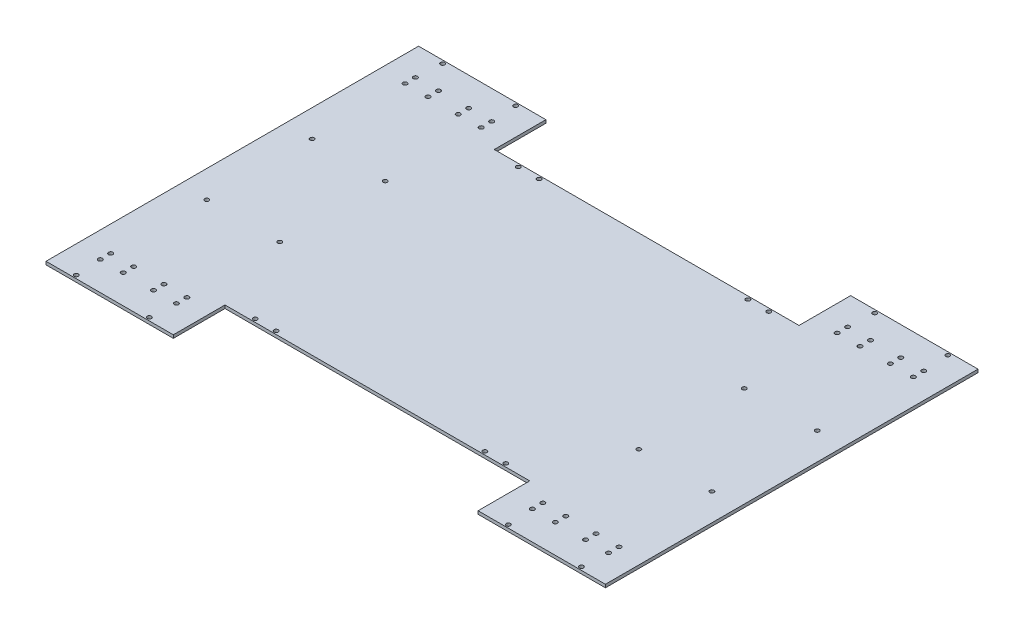
from build123d import *

# Parameters (mm, degrees)
EXTRUDE_1_DEPTH     = 3
SKETCH_6_R          = 2
SKETCH_6_R_2        = 2.05
CUT_EXTRUDE_2_DEPTH = 3


with BuildPart() as part:
    # 草图1 → 凸台-拉伸1 (new body)
    with BuildSketch(Plane(origin=(0, 0, 0), x_dir=(1, 0, 0), z_dir=(0, 1, 0))):
        Polygon((-268, 178.5), (-268, -178.5), (-146, -178.5), (-146, -129), (146, -129), (146, -178.5), (268, -178.5), (268, 178.5), (146, 178.5), (146, 129), (-146, 129), (-146, 178.5), align=None)
    extrude(amount=EXTRUDE_1_DEPTH)

    # 草图6 → 切除-拉伸2 (cut)
    with BuildSketch(Plane.XZ):
        with Locations(Location((172, 175.5, 0), (0, 0, 270))):
            Circle(SKETCH_6_R)
        with Locations(Location((242, 175.5, 0), (0, 0, 270))):
            Circle(SKETCH_6_R)
        with Locations(Location((170.5, 151, 0), (0, 0, 270))):
            Circle(SKETCH_6_R_2)
        with Locations(Location((192.5, 151, 0), (0, 0, 270))):
            Circle(SKETCH_6_R_2)
        with Locations(Location((192.5, 141, 0), (0, 0, 270))):
            Circle(SKETCH_6_R_2)
        with Locations(Location((170.5, 141, 0), (0, 0, 270))):
            Circle(SKETCH_6_R_2)
        with Locations(Location((221.5, 151, 0), (0, 0, 270))):
            Circle(SKETCH_6_R_2)
        with Locations(Location((221.5, 141, 0), (0, 0, 270))):
            Circle(SKETCH_6_R_2)
        with Locations(Location((243.5, 151, 0), (0, 0, 270))):
            Circle(SKETCH_6_R_2)
        with Locations(Location((243.5, 141, 0), (0, 0, 270))):
            Circle(SKETCH_6_R_2)
        with Locations(Location((172, 50.5, 0), (0, 0, 270))):
            Circle(SKETCH_6_R)
        with Locations(Location((242, 50.5, 0), (0, 0, 270))):
            Circle(SKETCH_6_R)
        with Locations(Location((100, 126, 0), (0, 0, 270))):
            Circle(SKETCH_6_R)
        with Locations(Location((120, 126, 0), (0, 0, 270))):
            Circle(SKETCH_6_R)
        with Locations(Location((242, -50.5, 0), (0, 0, 90))):
            Circle(SKETCH_6_R)
        with Locations(Location((172, -50.5, 0), (0, 0, 90))):
            Circle(SKETCH_6_R)
        with Locations(Location((243.5, -141, 0), (0, 0, 90))):
            Circle(SKETCH_6_R_2)
        with Locations(Location((243.5, -151, 0), (0, 0, 90))):
            Circle(SKETCH_6_R_2)
        with Locations(Location((221.5, -141, 0), (0, 0, 90))):
            Circle(SKETCH_6_R_2)
        with Locations(Location((221.5, -151, 0), (0, 0, 90))):
            Circle(SKETCH_6_R_2)
        with Locations(Location((192.5, -141, 0), (0, 0, 90))):
            Circle(SKETCH_6_R_2)
        with Locations(Location((170.5, -141, 0), (0, 0, 90))):
            Circle(SKETCH_6_R_2)
        with Locations(Location((170.5, -151, 0), (0, 0, 90))):
            Circle(SKETCH_6_R_2)
        with Locations(Location((192.5, -151, 0), (0, 0, 90))):
            Circle(SKETCH_6_R_2)
        with Locations(Location((242, -175.5, 0), (0, 0, 90))):
            Circle(SKETCH_6_R)
        with Locations(Location((172, -175.5, 0), (0, 0, 90))):
            Circle(SKETCH_6_R)
        with Locations(Location((120, -126, 0), (0, 0, 90))):
            Circle(SKETCH_6_R)
        with Locations(Location((100, -126, 0), (0, 0, 90))):
            Circle(SKETCH_6_R)
        with Locations(Location((-172, -175.5, 0), (0, 0, 270))):
            Circle(SKETCH_6_R)
        with Locations(Location((-242, -175.5, 0), (0, 0, 270))):
            Circle(SKETCH_6_R)
        with Locations(Location((-221.5, -151, 0), (0, 0, 270))):
            Circle(SKETCH_6_R_2)
        with Locations(Location((-243.5, -151, 0), (0, 0, 270))):
            Circle(SKETCH_6_R_2)
        with Locations(Location((-243.5, -141, 0), (0, 0, 270))):
            Circle(SKETCH_6_R_2)
        with Locations(Location((-221.5, -141, 0), (0, 0, 270))):
            Circle(SKETCH_6_R_2)
        with Locations(Location((-170.5, -151, 0), (0, 0, 270))):
            Circle(SKETCH_6_R_2)
        with Locations(Location((-192.5, -151, 0), (0, 0, 270))):
            Circle(SKETCH_6_R_2)
        with Locations(Location((-192.5, -141, 0), (0, 0, 270))):
            Circle(SKETCH_6_R_2)
        with Locations(Location((-170.5, -141, 0), (0, 0, 270))):
            Circle(SKETCH_6_R_2)
        with Locations(Location((-100, -126, 0), (0, 0, 270))):
            Circle(SKETCH_6_R)
        with Locations(Location((-120, -126, 0), (0, 0, 270))):
            Circle(SKETCH_6_R)
        with Locations(Location((-242, -50.5, 0), (0, 0, 270))):
            Circle(SKETCH_6_R)
        with Locations(Location((-172, -50.5, 0), (0, 0, 270))):
            Circle(SKETCH_6_R)
        with Locations(Location((-242, 50.5, 0), (0, 0, 90))):
            Circle(SKETCH_6_R)
        with Locations(Location((-172, 50.5, 0), (0, 0, 90))):
            Circle(SKETCH_6_R)
        with Locations(Location((-243.5, 141, 0), (0, 0, 90))):
            Circle(SKETCH_6_R_2)
        with Locations(Location((-243.5, 151, 0), (0, 0, 90))):
            Circle(SKETCH_6_R_2)
        with Locations(Location((-221.5, 141, 0), (0, 0, 90))):
            Circle(SKETCH_6_R_2)
        with Locations(Location((-221.5, 151, 0), (0, 0, 90))):
            Circle(SKETCH_6_R_2)
        with Locations(Location((-192.5, 141, 0), (0, 0, 90))):
            Circle(SKETCH_6_R_2)
        with Locations(Location((-170.5, 141, 0), (0, 0, 90))):
            Circle(SKETCH_6_R_2)
        with Locations(Location((-192.5, 151, 0), (0, 0, 90))):
            Circle(SKETCH_6_R_2)
        with Locations(Location((-170.5, 151, 0), (0, 0, 90))):
            Circle(SKETCH_6_R_2)
        with Locations(Location((-242, 175.5, 0), (0, 0, 90))):
            Circle(SKETCH_6_R)
        with Locations(Location((-172, 175.5, 0), (0, 0, 90))):
            Circle(SKETCH_6_R)
        with Locations(Location((-120, 126, 0), (0, 0, 90))):
            Circle(SKETCH_6_R)
        with Locations(Location((-100, 126, 0), (0, 0, 90))):
            Circle(SKETCH_6_R)
    extrude(amount=-CUT_EXTRUDE_2_DEPTH, mode=Mode.SUBTRACT)


solid = part.part
